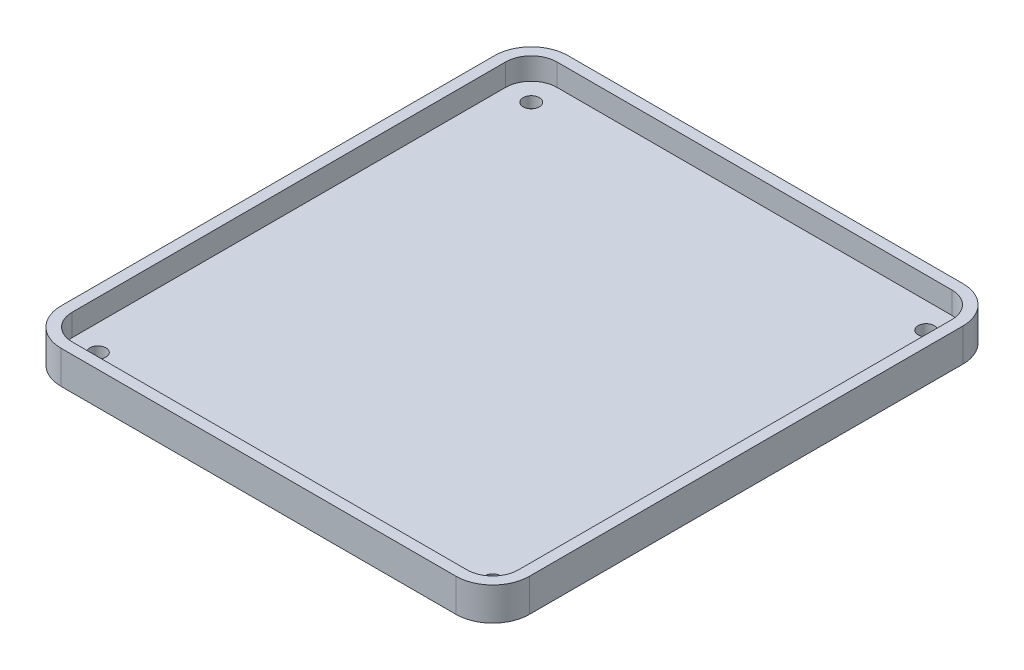
from build123d import *

# Parameters (mm, degrees)
EXTRUDE_1_DEPTH     = 3
EXTRUDE_2_DEPTH     = 6
SKETCH_3_R          = 2.2
CUT_EXTRUDE_1_DEPTH = 188.979387168


with BuildPart() as part:
    # 草图1 → 凸台-拉伸1 (new body)
    with BuildSketch(Plane(origin=(0, 0, 0), x_dir=(1, 0, 0), z_dir=(0, 1, 0))):
        with BuildLine():
            Line((10, 0), (117.5, 0))
            ThreePointArc((117.5, 0), (124.571067812, 2.928932188), (127.5, 10))
            Line((127.5, 10), (127.5, 128))
            ThreePointArc((127.5, 128), (124.571067812, 135.071067812), (117.5, 138))
            Line((117.5, 138), (10, 138))
            ThreePointArc((10, 138), (2.928932188, 135.071067812), (0, 128))
            Line((0, 128), (0, 10))
            ThreePointArc((0, 10), (2.928932188, 2.928932188), (10, 0))
        make_face()
    extrude(amount=EXTRUDE_1_DEPTH)

    # 草图2 → 凸台-拉伸2 (add)
    with BuildSketch(Plane(origin=(0, 3, 0), x_dir=(1, 0, 0), z_dir=(0, 1, 0))):
        with BuildLine():
            Line((0, 128), (0, 10))
            ThreePointArc((0, 10), (2.928932188, 2.928932188), (10, 0))
            Line((10, 0), (117.5, 0))
            ThreePointArc((117.5, 0), (124.571067812, 2.928932188), (127.5, 10))
            Line((127.5, 10), (127.5, 128))
            ThreePointArc((127.5, 128), (124.571067812, 135.071067812), (117.5, 138))
            Line((117.5, 138), (10, 138))
            ThreePointArc((10, 138), (2.928932188, 135.071067812), (0, 128))
        make_face()
        with BuildLine():
            Line((117.5, 135), (10, 135))
            ThreePointArc((10, 135), (5.050252532, 132.949747468), (3, 128))
            Line((3, 128), (3, 10))
            ThreePointArc((3, 10), (5.050252532, 5.050252532), (10, 3))
            Line((10, 3), (117.5, 3))
            ThreePointArc((117.5, 3), (122.449747468, 5.050252532), (124.5, 10))
            Line((124.5, 10), (124.5, 128))
            ThreePointArc((124.5, 128), (122.449747468, 132.949747468), (117.5, 135))
        make_face(mode=Mode.SUBTRACT)
    extrude(amount=EXTRUDE_2_DEPTH)

    # 草图3 → 切除-拉伸1 (cut, through all)
    with BuildSketch(Plane(origin=(0, 3, 0), x_dir=(1, 0, 0), z_dir=(0, 1, 0))):
        with Locations(Location((10, 128, 0), (0, 0, 270))):
            Circle(SKETCH_3_R)
        with Locations(Location((117.5, 128, 0), (0, 0, 270))):
            Circle(SKETCH_3_R)
        with Locations(Location((10, 10, 0), (0, 0, 270))):
            Circle(SKETCH_3_R)
        with Locations(Location((117.5, 10, 0), (0, 0, 270))):
            Circle(SKETCH_3_R)
    extrude(amount=-CUT_EXTRUDE_1_DEPTH, mode=Mode.SUBTRACT)


solid = part.part
